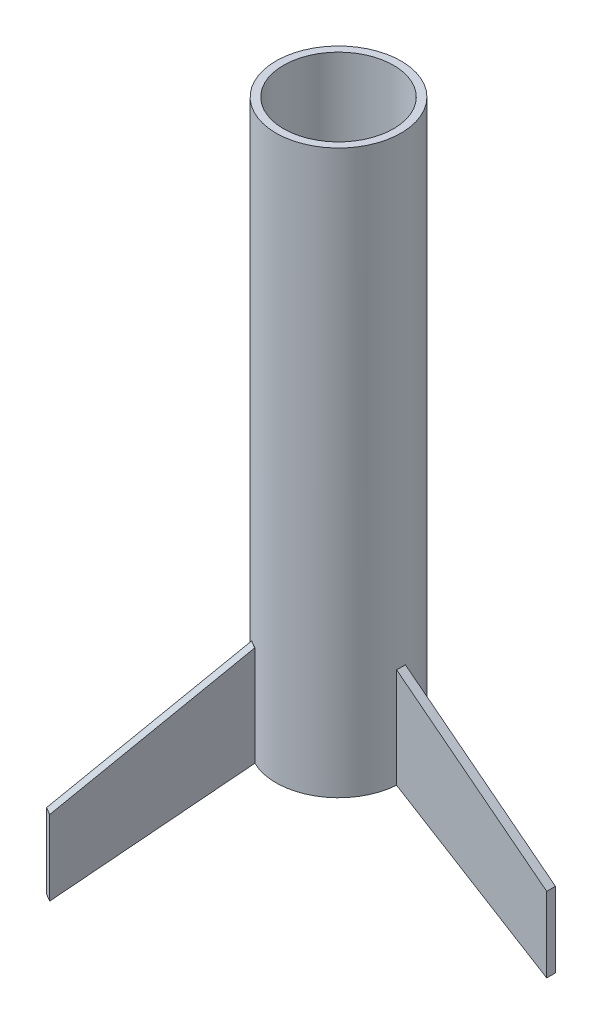
from build123d import *

# Parameters (mm, degrees)
SKETCH1_R           = 12.7
SKETCH1_R_2         = 11.176
BOSS_EXTRUDE1_DEPTH = 114.3
BOSS_EXTRUDE2_DEPTH = 0.889
CIRPATTERN1_COUNT   = 3
SKETCH3_R           = 11.176
SKETCH3_R_2         = 6.35
BOSS_EXTRUDE3_DEPTH = 3.175


with BuildPart() as part:
    # Sketch1 → Boss-Extrude1 (new body)
    with BuildSketch(Plane(origin=(0, 0, 0), x_dir=(1, 0, 0), z_dir=(0, 1, 0))):
        with Locations(Location((0, 0, 0), (0, 0, 270))):
            Circle(SKETCH1_R)
        with Locations(Location((0, 0, 0), (0, 0, 270))):
            Circle(SKETCH1_R_2, mode=Mode.SUBTRACT)
    extrude(amount=BOSS_EXTRUDE1_DEPTH)

    # Sketch2 → Boss-Extrude2 (add, symmetric)
    with BuildSketch(Plane.XY):
        Polygon((12.7, 0), (11.176, 0), (11.176, 20.32), (12.7, 20.32), (43.18, -3.408032613), (43.18, -18.648032613), align=None)
    boss_extrude2 = extrude(amount=BOSS_EXTRUDE2_DEPTH, both=True)

    # CirPattern1: Boss-Extrude2 ×3 about axis
    cirpattern1_axis = Axis((0, 0, 0), (0, 1, 0))
    for i in range(1, CIRPATTERN1_COUNT):
        add(boss_extrude2.rotate(cirpattern1_axis, i * 360 / CIRPATTERN1_COUNT))

    # Sketch3 → Boss-Extrude3 (add)
    with BuildSketch(Plane(origin=(0, 63.5, 0), x_dir=(1, 0, 0), z_dir=(0, 1, 0))):
        with Locations(Location((0, 0, 0), (0, 0, 270))):
            Circle(SKETCH3_R)
        with Locations(Location((0, 0, 0), (0, 0, 270))):
            Circle(SKETCH3_R_2, mode=Mode.SUBTRACT)
    extrude(amount=BOSS_EXTRUDE3_DEPTH)


solid = part.part
